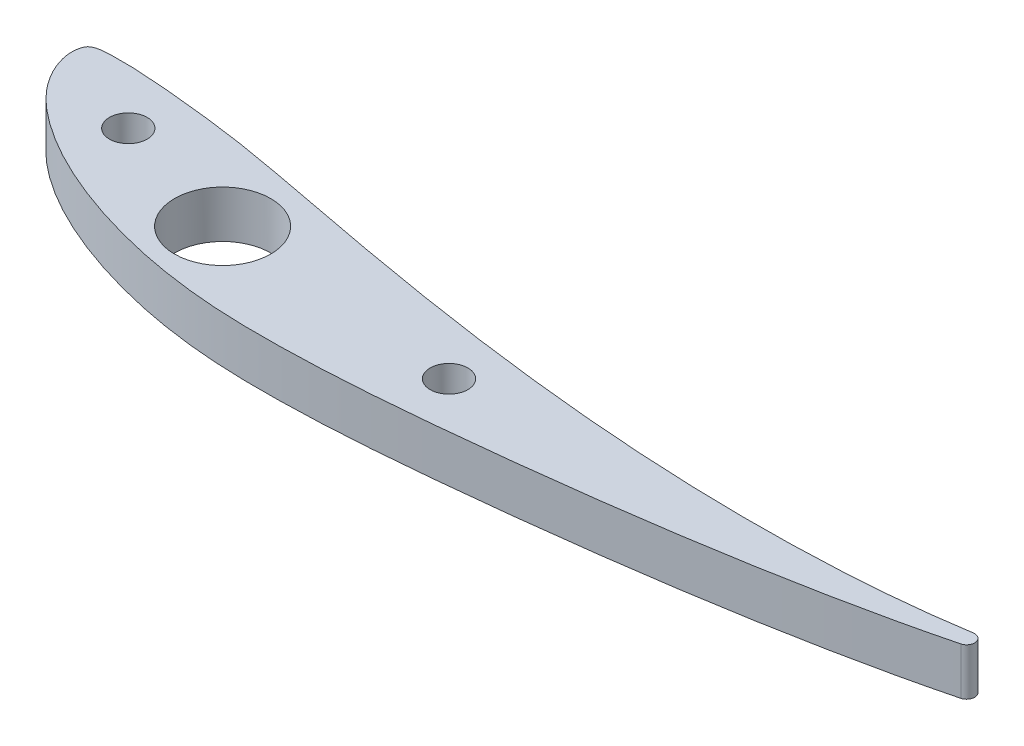
from build123d import *

# Parameters (mm, degrees)
BOSS_EXTRUDE1_DEPTH     = 6.35
CUT_EXTRUDE2_DEPTH      = 152.504993052
CUT_EXTRUDE2_DEPTH_BACK = 152.504993052
SKETCH3_R               = 6.477
CUT_EXTRUDE3_DEPTH      = 152.504993052
CUT_EXTRUDE3_DEPTH_BACK = 152.504993052
SKETCH4_R               = 2.54
CUT_EXTRUDE4_DEPTH      = 152.504993052
CUT_EXTRUDE4_DEPTH_BACK = 152.504993052


with BuildPart() as part:
    # Sketch1 → Boss-Extrude1 (new body)
    with BuildSketch(Plane(origin=(0, 0, 0), x_dir=(1, 0, 0), z_dir=(0, 1, 0))):
        with BuildLine():
            add(Edge.make_bspline(
                [(150, 0), (149.999082428, 0.00389582), (149.419672053, -0.389722724), (148.777054722, -0.778630867), (147.10425347, -1.783608513), (144.835255918, -2.870659693), (141.654931001, -4.058768874), (137.768772177, -5.172286572), (133.222466898, -6.213228852), (128.099790299, -7.129925146), (122.460796636, -7.891712549), (116.378899618, -8.47651792), (109.926502557, -8.861949019), (103.181194498, -9.043034696), (96.220212479, -9.015563475), (89.12121774, -8.781537996), (81.961225488, -8.353867109), (74.815043572, -7.749542113), (67.754389033, -6.98433614), (60.84596827, -6.092687983), (54.151912971, -5.10060815), (47.729921804, -4.044554377), (41.629826364, -2.959847737), (35.896437262, -1.887259389), (30.565779247, -0.87137858), (25.663915288, 0.062060314), (21.166377749, 0.806236455), (17.051277595, 1.338376169), (13.320593128, 1.753158027), (9.992512373, 2.059516322), (7.101092135, 2.250496961), (4.678500519, 2.354128591), (2.752146356, 2.285712507), (1.343995906, 2.215322014), (0.296818428, 1.716691682), (0.015403473, 0.712842885), (-0.032035919, -0.381585184), (0.216127101, -1.675493179), (0.736478586, -3.077257538), (1.548148665, -4.553558888), (2.64680221, -6.07094315), (4.07694345, -7.582573991), (5.831765897, -9.075358736), (7.885834611, -10.565607603), (10.238291416, -12.021718271), (12.874380162, -13.423953282), (15.779756793, -14.756361132), (18.945096058, -15.991873011), (22.350728531, -17.123870434), (25.982162907, -18.12585917), (29.824029484, -18.980075612), (33.872365271, -19.639079334), (38.128147898, -20.104651311), (42.608686172, -20.333578775), (47.315722089, -20.344413104), (52.2405057, -20.225708001), (57.357799405, -19.952994499), (62.63914418, -19.557277599), (68.054377517, -19.059619846), (73.565421497, -18.487940308), (79.127380563, -17.852918563), (84.694213673, -17.170545382), (90.221414687, -16.436018088), (95.668949043, -15.65169482), (101.001904957, -14.823788108), (106.185791669, -13.95069676), (111.190736162, -13.04365081), (115.985219841, -12.103954556), (120.54122319, -11.14316085), (124.830924819, -10.16621042), (128.828757145, -9.179204869), (132.511800064, -8.189287012), (135.859718648, -7.205541542), (138.853765182, -6.232586734), (141.478397693, -5.278866555), (143.721372274, -4.351116162), (145.57927393, -3.462244043), (147.073285763, -2.545188031), (148.165385918, -1.635644887), (149.091049021, -0.7806922), (149.507930169, -0.371377778), (150.000899289, -0.003818197), (150, 0)],
                knots=[0, 0, 0, 0, 0.000999594, 0.004147435, 0.009748209, 0.018044377, 0.028864178, 0.04183079, 0.056713807, 0.073341232, 0.091507989, 0.111021837, 0.131661709, 0.153207715, 0.175433402, 0.198110317, 0.221011446, 0.243905882, 0.266573311, 0.288810349, 0.310405036, 0.331177743, 0.350943876, 0.3695564, 0.386864963, 0.402753039, 0.417195876, 0.430379519, 0.442362633, 0.453032156, 0.462284346, 0.470026206, 0.476176645, 0.480649947, 0.483553073, 0.486420689, 0.489953231, 0.494096927, 0.498850588, 0.50419675, 0.510125492, 0.516691031, 0.524011699, 0.532092122, 0.540897921, 0.550403414, 0.560581041, 0.571396483, 0.582828081, 0.594829641, 0.607347037, 0.620384325, 0.633968937, 0.648199967, 0.663193937, 0.678898581, 0.695226562, 0.712113221, 0.729459406, 0.747143117, 0.765009772, 0.782904928, 0.800688045, 0.818242105, 0.835449083, 0.852211621, 0.868429578, 0.884009363, 0.898854951, 0.912881827, 0.92601075, 0.938166771, 0.949289699, 0.959322172, 0.968216949, 0.97594822, 0.982474409, 0.987904723, 0.992516501, 0.996351138, 0.999020322, 1, 1, 1, 1], degree=3))
        make_face()
    extrude(amount=BOSS_EXTRUDE1_DEPTH)

    # Sketch3 → Cut-Extrude2 (cut, two sides: drawn at the far end of the back side and taken through both)
    with BuildSketch(Plane(origin=(0, 6.35, 0), x_dir=(1, 0, 0), z_dir=(0, 1, 0)).offset(-CUT_EXTRUDE2_DEPTH_BACK)):
        with Locations(Location((30.48, -10.16, 0), (0, 0, 270))):
            Circle(SKETCH3_R)
    extrude(amount=CUT_EXTRUDE2_DEPTH + CUT_EXTRUDE2_DEPTH_BACK, mode=Mode.SUBTRACT)

    # Sketch4 → Cut-Extrude3 (cut, two sides: drawn at the far end of the back side and taken through both)
    with BuildSketch(Plane(origin=(0, 6.35, 0), x_dir=(1, 0, 0), z_dir=(0, 1, 0)).offset(-CUT_EXTRUDE3_DEPTH_BACK)):
        with Locations(Location((12.7, -5.08, 0), (0, 0, 270))):
            Circle(SKETCH4_R)
        with Locations(Location((63.5, -12.7, 0), (0, 0, 270))):
            Circle(SKETCH4_R)
    extrude(amount=CUT_EXTRUDE3_DEPTH + CUT_EXTRUDE3_DEPTH_BACK, mode=Mode.SUBTRACT)

    # Sketch5 → Cut-Extrude4 (cut, two sides: drawn at the far end of the back side and taken through both)
    with BuildSketch(Plane(origin=(0, 6.35, 0), x_dir=(1, 0, 0), z_dir=(0, 1, 0)).offset(-CUT_EXTRUDE4_DEPTH_BACK)):
        with BuildLine():
            Line((128.845706187, -9.160794175), (154.930263272, -7.449375455))
            Line((154.930263272, -7.449375455), (149.554367652, 4.756274349))
            Line((149.554367652, 4.756274349), (128.346073724, -7.051595138))
            ThreePointArc((128.346073724, -7.051595138), (129.650489474, -7.856378425), (128.845706187, -9.160794175))
        make_face()
    extrude(amount=CUT_EXTRUDE4_DEPTH + CUT_EXTRUDE4_DEPTH_BACK, mode=Mode.SUBTRACT)


solid = part.part
